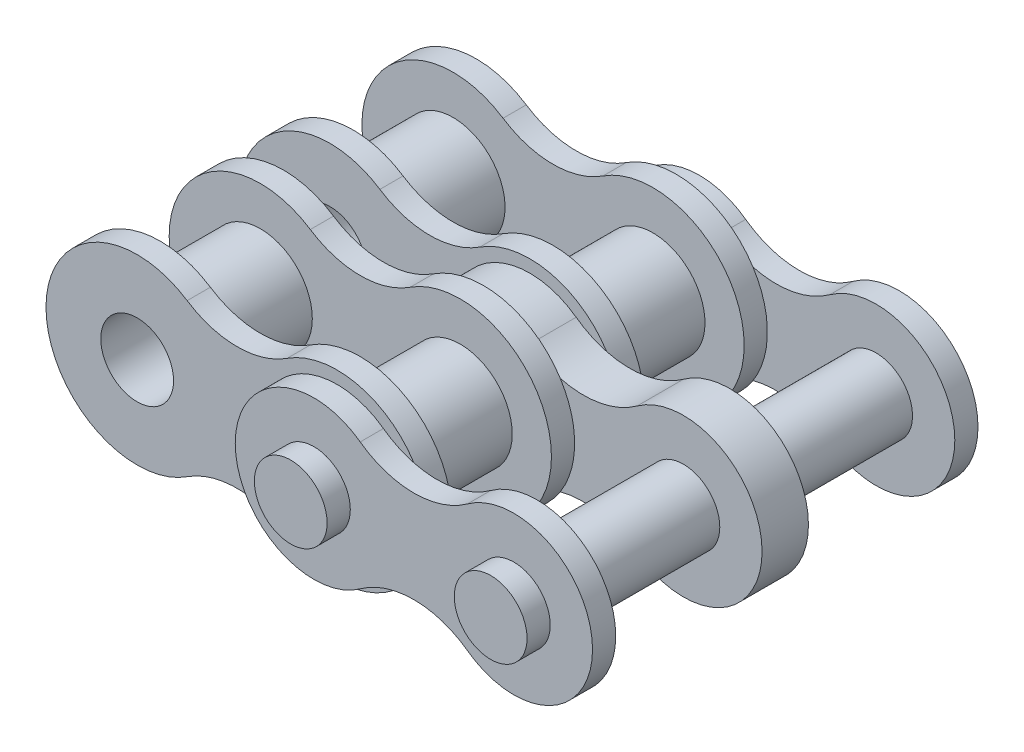
from build123d import *
from build123d.topology import SkipClean

# Parameters (mm, degrees)
SKETCH1_R                 = 1.1557
BOSS_EXTRUDE1_DEPTH       = 0.7366
BOSS_EXTRUDE2_START       = 3.175
SKETCH2_R                 = 1.651
SKETCH2_R_2               = 1.1557
BOSS_EXTRUDE2_DEPTH       = 3.175
BOSS_EXTRUDE3_START       = -3.9116
SKETCH1_2_R               = 1.1557
BOSS_EXTRUDE3_DEPTH       = 0.7366
BOSS_EXTRUDE4_START       = -5.3848
SKETCH1_3_R               = 1.1557
BOSS_EXTRUDE4_DEPTH       = 0.7366
BOSS_EXTRUDE5_START       = 9.2964
SKETCH2_2_R               = 1.651
SKETCH2_2_R_2             = 1.1557
BOSS_EXTRUDE5_DEPTH       = 3.175
BOSS_EXTRUDE6_START       = -10.033
SKETCH1_4_R               = 1.1557
BOSS_EXTRUDE6_DEPTH       = 0.7366
BOSS_EXTRUDE7_DEPTH       = 0.7366
BOSS_EXTRUDE8_START       = -6.1214
BOSS_EXTRUDE8_DEPTH       = 1.4732
BOSS_EXTRUDE9_START       = -11.5062
BOSS_EXTRUDE9_DEPTH       = 0.7366
BOSS_EXTRUDE10_DEPTH      = 0.7366
BOSS_EXTRUDE10_DEPTH_BACK = 12.9794
SKETCH4_R                 = 1.1557


with BuildPart() as part:
    # Sketch1 → Boss-Extrude1 (new body)
    with BuildSketch(Plane.XY):
        with BuildLine():
            ThreePointArc((-1.5875, 2.421640582), (-6.0706, 0), (-1.5875, -2.421640582))
            ThreePointArc((-1.5875, -2.421640582), (0, -1.947681165), (1.5875, -2.421640582))
            ThreePointArc((1.5875, -2.421640582), (6.0706, 0), (1.5875, 2.421640582))
            ThreePointArc((1.5875, 2.421640582), (0, 1.947681165), (-1.5875, 2.421640582))
        make_face()
        with Locations((-3.175, 0)):
            Circle(SKETCH1_R, mode=Mode.SUBTRACT)
        with Locations((3.175, 0)):
            Circle(SKETCH1_R, mode=Mode.SUBTRACT)
    extrude(amount=BOSS_EXTRUDE1_DEPTH)

    # Sketch2 → Boss-Extrude2 (add)
    # profile 1 of 2: a face of its own
    with SkipClean():  # the faces are left unmerged after this step: merging them gives an invalid solid
        with BuildSketch(Plane(origin=(0, 0, 0), x_dir=(-1, 0, 0), z_dir=(0, 0, -1)).offset(BOSS_EXTRUDE2_START)):
            with Locations(Location((3.175, 0, 0), (0, 0, 180))):
                Circle(SKETCH2_R)
            with Locations((3.175, 0)):
                Circle(SKETCH2_R_2, mode=Mode.SUBTRACT)
        # profile 2 of 2: a face of its own
        with BuildSketch(Plane(origin=(0, 0, 0), x_dir=(-1, 0, 0), z_dir=(0, 0, -1)).offset(BOSS_EXTRUDE2_START)):
            with Locations(Location((-3.175, 0, 0), (0, 0, 180))):
                Circle(SKETCH2_R)
            with Locations((-3.175, 0)):
                Circle(SKETCH2_R_2, mode=Mode.SUBTRACT)
        extrude(amount=-BOSS_EXTRUDE2_DEPTH)

    # Sketch1<2> → Boss-Extrude3 (add)
    with SkipClean():  # the faces are left unmerged after this step: merging them gives an invalid solid
        with BuildSketch(Plane.XY.offset(BOSS_EXTRUDE3_START)):
            with BuildLine():
                ThreePointArc((-1.5875, 2.421640582), (-6.0706, 0), (-1.5875, -2.421640582))
                ThreePointArc((-1.5875, -2.421640582), (0, -1.947681165), (1.5875, -2.421640582))
                ThreePointArc((1.5875, -2.421640582), (6.0706, 0), (1.5875, 2.421640582))
                ThreePointArc((1.5875, 2.421640582), (0, 1.947681165), (-1.5875, 2.421640582))
            make_face()
            with Locations(Location((-3.175, 0, 0), (0, 0, 180))):
                Circle(SKETCH1_2_R, mode=Mode.SUBTRACT)
            with Locations(Location((3.175, 0, 0), (0, 0, 180))):
                Circle(SKETCH1_2_R, mode=Mode.SUBTRACT)
        extrude(amount=BOSS_EXTRUDE3_DEPTH)

    # Sketch3 → Boss-Extrude7 (add)
    with SkipClean():  # the faces are left unmerged after this step: merging them gives an invalid solid
        with BuildSketch(Plane.XY.offset(0.7366)):
            with BuildLine():
                ThreePointArc((4.645703355, 2.020063927), (0.676275, 0), (4.645703355, -2.020063927))
                ThreePointArc((4.645703355, -2.020063927), (6.35, -1.465376634), (8.054296645, -2.020063927))
                ThreePointArc((8.054296645, -2.020063927), (12.023725, 0), (8.054296645, 2.020063927))
                ThreePointArc((8.054296645, 2.020063927), (6.35, 1.465376634), (4.645703355, 2.020063927))
            make_face()
        extrude(amount=BOSS_EXTRUDE7_DEPTH)



with BuildPart() as body_2:
    # Sketch1<3> → Boss-Extrude4 (new body)
    with BuildSketch(Plane.XY.offset(BOSS_EXTRUDE4_START)):
        with BuildLine():
            ThreePointArc((-1.5875, 2.421640582), (-6.0706, 0), (-1.5875, -2.421640582))
            ThreePointArc((-1.5875, -2.421640582), (0, -1.947681165), (1.5875, -2.421640582))
            ThreePointArc((1.5875, -2.421640582), (6.0706, 0), (1.5875, 2.421640582))
            ThreePointArc((1.5875, 2.421640582), (0, 1.947681165), (-1.5875, 2.421640582))
        make_face()
        with Locations(Location((-3.175, 0, 0), (0, 0, 180))):
            Circle(SKETCH1_3_R, mode=Mode.SUBTRACT)
        with Locations(Location((3.175, 0, 0), (0, 0, 180))):
            Circle(SKETCH1_3_R, mode=Mode.SUBTRACT)
    extrude(amount=-BOSS_EXTRUDE4_DEPTH)

    # Sketch2<2> → Boss-Extrude5 (add)
    # profile 1 of 2: a face of its own
    with BuildSketch(Plane(origin=(0, 0, 0), x_dir=(-1, 0, 0), z_dir=(0, 0, -1)).offset(BOSS_EXTRUDE5_START)):
        with Locations((3.175, 0)):
            Circle(SKETCH2_2_R)
        with Locations((3.175, 0)):
            Circle(SKETCH2_2_R_2, mode=Mode.SUBTRACT)
    # profile 2 of 2: a face of its own
    with BuildSketch(Plane(origin=(0, 0, 0), x_dir=(-1, 0, 0), z_dir=(0, 0, -1)).offset(BOSS_EXTRUDE5_START)):
        with Locations((-3.175, 0)):
            Circle(SKETCH2_2_R)
        with Locations((-3.175, 0)):
            Circle(SKETCH2_2_R_2, mode=Mode.SUBTRACT)
    extrude(amount=-BOSS_EXTRUDE5_DEPTH)

    # Sketch1<4> → Boss-Extrude6 (add)
    with BuildSketch(Plane.XY.offset(BOSS_EXTRUDE6_START)):
        with BuildLine():
            ThreePointArc((-1.5875, 2.421640582), (-6.0706, 0), (-1.5875, -2.421640582))
            ThreePointArc((-1.5875, -2.421640582), (0, -1.947681165), (1.5875, -2.421640582))
            ThreePointArc((1.5875, -2.421640582), (6.0706, 0), (1.5875, 2.421640582))
            ThreePointArc((1.5875, 2.421640582), (0, 1.947681165), (-1.5875, 2.421640582))
        make_face()
        with Locations(Location((-3.175, 0, 0), (0, 0, 180))):
            Circle(SKETCH1_4_R, mode=Mode.SUBTRACT)
        with Locations(Location((3.175, 0, 0), (0, 0, 180))):
            Circle(SKETCH1_4_R, mode=Mode.SUBTRACT)
    extrude(amount=BOSS_EXTRUDE6_DEPTH)


with BuildPart() as part_1:
    with SkipClean():  # the faces are left unmerged after this step: merging them gives an invalid solid
        add(part.part)

        add(body_2.part)  # Boss-Extrude8 merges body 2
        # Sketch3<2> → Boss-Extrude8 (add)
        with BuildSketch(Plane.XY.offset(0.7366).offset(BOSS_EXTRUDE8_START)):
            with BuildLine():
                ThreePointArc((4.645703355, 2.020063927), (0.676275, 0), (4.645703355, -2.020063927))
                ThreePointArc((4.645703355, -2.020063927), (6.35, -1.465376634), (8.054296645, -2.020063927))
                ThreePointArc((8.054296645, -2.020063927), (12.023725, 0), (8.054296645, 2.020063927))
                ThreePointArc((8.054296645, 2.020063927), (6.35, 1.465376634), (4.645703355, 2.020063927))
            make_face()
        extrude(amount=BOSS_EXTRUDE8_DEPTH)

    # Sketch3<3> → Boss-Extrude9 (add)
    with BuildSketch(Plane.XY.offset(0.7366).offset(BOSS_EXTRUDE9_START)):
        with BuildLine():
            ThreePointArc((4.645703355, 2.020063927), (0.676275, 0), (4.645703355, -2.020063927))
            ThreePointArc((4.645703355, -2.020063927), (6.35, -1.465376634), (8.054296645, -2.020063927))
            ThreePointArc((8.054296645, -2.020063927), (12.023725, 0), (8.054296645, 2.020063927))
            ThreePointArc((8.054296645, 2.020063927), (6.35, 1.465376634), (4.645703355, 2.020063927))
        make_face()
    extrude(amount=BOSS_EXTRUDE9_DEPTH)

    # Sketch4 → Boss-Extrude10 (add, two sides: drawn at the far end of the back side and taken through both)
    with BuildSketch(Plane.XY.offset(1.4732).offset(-BOSS_EXTRUDE10_DEPTH_BACK)):
        with Locations(Location((3.175, 0, 0), (0, 0, 180))):
            Circle(SKETCH4_R)
        with Locations(Location((9.525, 0, 0), (0, 0, 180))):
            Circle(SKETCH4_R)
    extrude(amount=BOSS_EXTRUDE10_DEPTH + BOSS_EXTRUDE10_DEPTH_BACK)


solid = part_1.part
